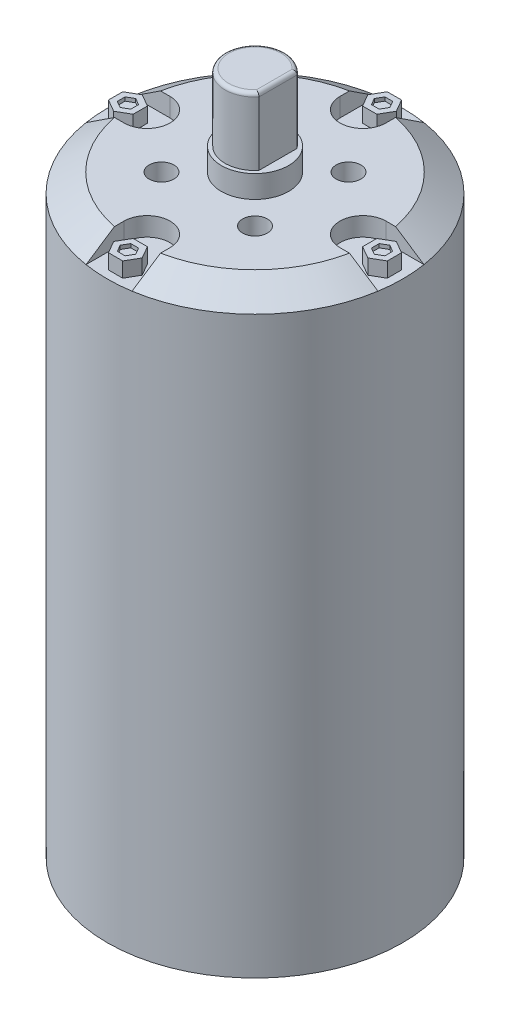
from build123d import *

# Parameters (mm, degrees)
SKETCH1_R           = 39.5
BOSS_EXTRUDE1_DEPTH = 153.67
CUT_EXTRUDE1_START  = -5
CUT_EXTRUDE1_DEPTH  = 5
SKETCH4_5_R         = 9
BOSS_EXTRUDE2_DEPTH = 6
BOSS_EXTRUDE3_DEPTH = 18
SKETCH4_7_R         = 3.3
CUT_EXTRUDE3_DEPTH  = 17
BOSS_EXTRUDE4_DEPTH = 4
CUT_EXTRUDE5_DEPTH  = 1
SKETCH9_R           = 6.042977367
CUT_EXTRUDE6_DEPTH  = 10
CIRPATTERN1_COUNT   = 8
SKETCH9_3_R         = 10.665128642
CUT_EXTRUDE7_DEPTH  = 10
BOSS_EXTRUDE5_START = 9
SKETCH10_R          = 8
BOSS_EXTRUDE5_DEPTH = 9
FILLET3_R           = 0.5
FILLET4_R           = 1


with BuildPart() as part:
    # Sketch1 → Boss-Extrude1 (new body)
    with BuildSketch(Plane(origin=(0, 0, 0), x_dir=(1, 0, 0), z_dir=(0, 1, 0))):
        with Locations(Location((0, 0, 0), (0, 0, 270))):
            Circle(SKETCH1_R)
    extrude(amount=BOSS_EXTRUDE1_DEPTH)

    # Sketch2 → Revolve1 (revolve)
    with BuildSketch(Plane.XY, mode=Mode.PRIVATE) as revolve1_sk:
        Polygon((0, 153.67), (-39.5, 153.67), (-32, 158.67), (0, 158.67), align=None)
    revolve(revolve1_sk.sketch.rotate(Axis((0, 158.67, 0), (0, -1, 0)), 270), axis=Axis((0, 158.67, 0), (0, -1, 0)))

    # Sketch4 → Cut-Extrude1 (cut)
    with BuildSketch(Plane(origin=(0, 158.67, 0), x_dir=(1, 0, 0), z_dir=(0, 1, 0)).offset(CUT_EXTRUDE1_START)):
        with BuildLine():
            Line((-39.017846302, 6.152858683), (-28.858540725, 6.152858683))
            ThreePointArc((-28.858540725, 6.152858683), (-22.705682042, 0), (-28.858540725, -6.152858683))
            Line((-28.858540725, -6.152858683), (-39.017846302, -6.152858683))
            ThreePointArc((-39.017846302, -6.152858683), (-39.5, 0), (-39.017846302, 6.152858683))
        make_face()
        with BuildLine():
            Line((-6.152858683, 39.017846302), (-6.152858683, 28.858540725))
            ThreePointArc((-6.152858683, 28.858540725), (0, 22.705682042), (6.152858683, 28.858540725))
            Line((6.152858683, 28.858540725), (6.152858683, 39.017846302))
            ThreePointArc((6.152858683, 39.017846302), (0, 39.5), (-6.152858683, 39.017846302))
        make_face()
        with BuildLine():
            Line((39.017846302, 6.152858683), (28.858540725, 6.152858683))
            ThreePointArc((28.858540725, 6.152858683), (22.705682042, 0), (28.858540725, -6.152858683))
            Line((28.858540725, -6.152858683), (39.017846302, -6.152858683))
            ThreePointArc((39.017846302, -6.152858683), (39.5, 0), (39.017846302, 6.152858683))
        make_face()
        with BuildLine():
            Line((6.152858683, -39.017846302), (6.152858683, -28.858540725))
            ThreePointArc((6.152858683, -28.858540725), (0, -22.705682042), (-6.152858683, -28.858540725))
            Line((-6.152858683, -28.858540725), (-6.152858683, -39.017846302))
            ThreePointArc((-6.152858683, -39.017846302), (0, -39.5), (6.152858683, -39.017846302))
        make_face()
    extrude(amount=CUT_EXTRUDE1_DEPTH, mode=Mode.SUBTRACT)

    # Sketch4<5> → Boss-Extrude2 (add)
    with BuildSketch(Plane(origin=(0, 158.67, 0), x_dir=(1, 0, 0), z_dir=(0, 1, 0))):
        with Locations(Location((0, 0, 0), (0, 0, 270))):
            Circle(SKETCH4_5_R)
    extrude(amount=BOSS_EXTRUDE2_DEPTH)

    # Sketch5 → Boss-Extrude3 (add)
    with BuildSketch(Plane(origin=(0, 164.67, 0), x_dir=(1, 0, 0), z_dir=(0, 1, 0))):
        with BuildLine():
            Line((6.156533816, 5.108531235), (6.156533816, -5.108531235))
            ThreePointArc((6.156533816, -5.108531235), (-8, 0), (6.156533816, 5.108531235))
        make_face()
    extrude(amount=BOSS_EXTRUDE3_DEPTH)

    # Sketch4<7> → Cut-Extrude3 (cut)
    with BuildSketch(Plane(origin=(0, 158.67, 0), x_dir=(1, 0, 0), z_dir=(0, 1, 0))):
        with Locations(Location((12.5, 12.5, 0), (0, 0, 270))):
            Circle(SKETCH4_7_R)
        with Locations(Location((-12.5, 12.5, 0), (0, 0, 90))):
            Circle(SKETCH4_7_R)
        with Locations(Location((12.5, -12.5, 0), (0, 0, 90))):
            Circle(SKETCH4_7_R)
        with Locations(Location((-12.5, -12.5, 0), (0, 0, 270))):
            Circle(SKETCH4_7_R)
    extrude(amount=-CUT_EXTRUDE3_DEPTH, mode=Mode.SUBTRACT)

    # Sketch6 → Boss-Extrude4 (add)
    with BuildSketch(Plane(origin=(0, 153.67, 0), x_dir=(1, 0, 0), z_dir=(0, 1, 0))):
        Polygon((1.905255888, -30.661808974), (-1.905255888, -30.661808974), (-3.810511777, -33.961808974), (-1.905255888, -37.261808974), (1.905255888, -37.261808974), (3.810511777, -33.961808974), align=None)
        Polygon((-37.261808974, 1.905255888), (-37.261808974, -1.905255888), (-33.961808974, -3.810511777), (-30.661808974, -1.905255888), (-30.661808974, 1.905255888), (-33.961808974, 3.810511777), align=None)
        Polygon((1.905255888, 37.261808974), (-1.905255888, 37.261808974), (-3.810511777, 33.961808974), (-1.905255888, 30.661808974), (1.905255888, 30.661808974), (3.810511777, 33.961808974), align=None)
        Polygon((37.261808974, -1.905255888), (37.261808974, 1.905255888), (33.961808974, 3.810511777), (30.661808974, 1.905255888), (30.661808974, -1.905255888), (33.961808974, -3.810511777), align=None)
    extrude(amount=BOSS_EXTRUDE4_DEPTH)

    # Sketch8 → Cut-Extrude5 (cut)
    with BuildSketch(Plane(origin=(0, 157.67, 0), x_dir=(1, 0, 0), z_dir=(0, 1, 0))):
        Polygon((-35.761808974, 1.039230485), (-35.761808974, -1.039230485), (-33.961808974, -2.078460969), (-32.161808974, -1.039230485), (-32.161808974, 1.039230485), (-33.961808974, 2.078460969), align=None)
        Polygon((-1.039230485, -35.761808974), (1.039230485, -35.761808974), (2.078460969, -33.961808974), (1.039230485, -32.161808974), (-1.039230485, -32.161808974), (-2.078460969, -33.961808974), align=None)
        Polygon((1.039230485, 35.761808974), (-1.039230485, 35.761808974), (-2.078460969, 33.961808974), (-1.039230485, 32.161808974), (1.039230485, 32.161808974), (2.078460969, 33.961808974), align=None)
        Polygon((35.761808974, -1.039230485), (35.761808974, 1.039230485), (33.961808974, 2.078460969), (32.161808974, 1.039230485), (32.161808974, -1.039230485), (33.961808974, -2.078460969), align=None)
    extrude(amount=-CUT_EXTRUDE5_DEPTH, mode=Mode.SUBTRACT)

    # Sketch9 → Cut-Extrude6 (cut)
    with BuildSketch(Plane.XZ):
        with Locations(Location((22.400920741, -0.076389237, 0), (0, 0, 270))):
            Circle(SKETCH9_R)
    cut_extrude6 = extrude(amount=-CUT_EXTRUDE6_DEPTH, mode=Mode.SUBTRACT)

    # CirPattern1: Cut-Extrude6 ×8 about axis
    cirpattern1_axis = Axis((-0.536857588, 0, 0.001830735), (0, 1, 0))
    for i in range(1, CIRPATTERN1_COUNT):
        add(cut_extrude6.rotate(cirpattern1_axis, i * 360 / CIRPATTERN1_COUNT), mode=Mode.SUBTRACT)

    # Sketch9<3> → Cut-Extrude7 (cut)
    with BuildSketch(Plane.XZ):
        with Locations(Location((0, 0, 0), (0, 0, 270))):
            Circle(SKETCH9_3_R)
    extrude(amount=-CUT_EXTRUDE7_DEPTH, mode=Mode.SUBTRACT)

    # Sketch10 → Boss-Extrude5 (add)
    with BuildSketch(Plane.XZ.offset(-10).offset(BOSS_EXTRUDE5_START)):
        with Locations(Location((0, 0, 0), (0, 0, 270))):
            Circle(SKETCH10_R)
    extrude(amount=-BOSS_EXTRUDE5_DEPTH)

    # Fillet3
    fillet3_edges = [part.edges().sort_by_distance(p)[0] for p in [
        (0, 1, 8),
    ]]
    fillet(fillet3_edges, radius=FILLET3_R)

    # Fillet4
    fillet4_edges = [part.edges().sort_by_distance(p)[0] for p in [
        (6.156533816, 182.67, 0),
        (-8, 182.67, 0),
    ]]
    fillet(fillet4_edges, radius=FILLET4_R)


solid = part.part
